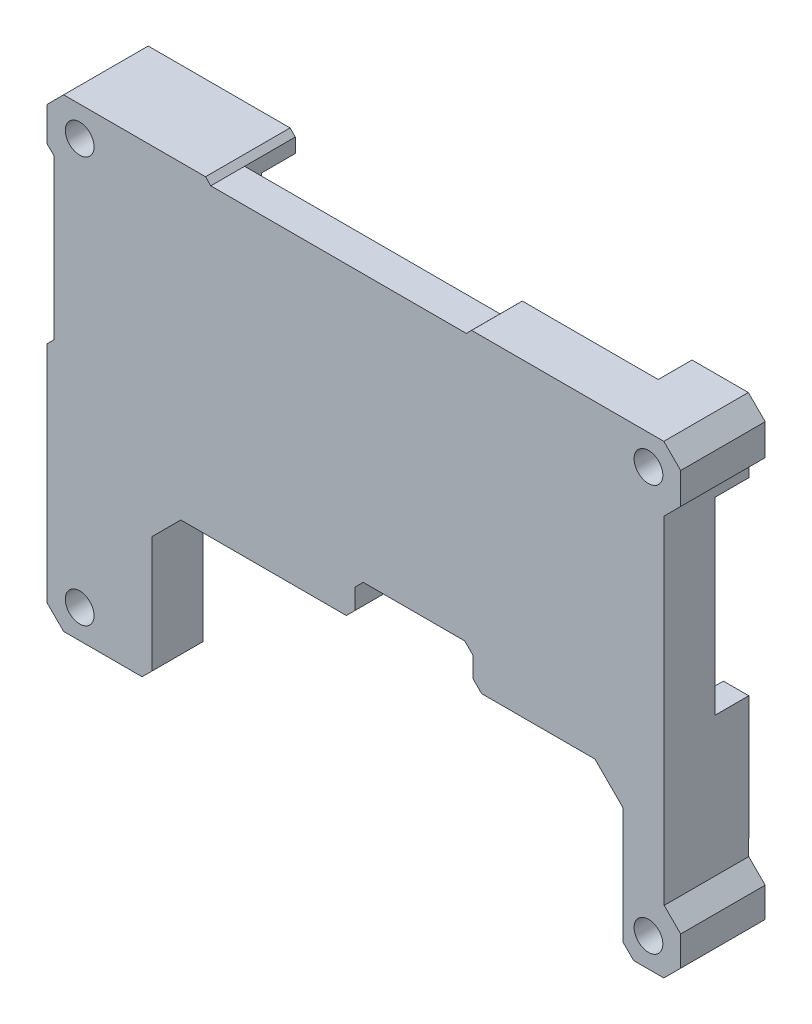
from build123d import *

# Parameters (mm, degrees)
SKETCH_1_W           = 85
SKETCH_1_H           = 65
EXTRUDE_1_DEPTH      = 10
CUT_EXTRUDE_1_REACH  = 109.471
SKETCH_2_R           = 1.7
CUT_EXTRUDE_2_REACH  = 109.471
SKETCH_3_W           = 85
SKETCH_3_H           = 65
CUT_EXTRUDE_4_REACH  = 102.464
CUT_EXTRUDE_7_DEPTH  = 6
CUT_EXTRUDE_8_DEPTH  = 6
CUT_EXTRUDE_11_DEPTH = 4
SKETCH_8_W           = 8
SKETCH_8_H           = 5
CUT_EXTRUDE_12_DEPTH = 1
SKETCH_10_W          = 5.4
SKETCH_10_H          = 6
SKETCH_10_W_2        = 4
EXTRUDE_2_DEPTH      = 3.04
SKETCH_11_W          = 4.2
SKETCH_11_H          = 5
EXTRUDE_3_DEPTH      = 2.300115
SKETCH_12_W          = 12
SKETCH_12_H          = 6
EXTRUDE_4_DEPTH      = 2.89
SKETCH_13_W          = 6.499986347
SKETCH_13_H          = 5.115524378
EXTRUDE_5_DEPTH      = 3.6
SKETCH_14_W          = 6
SKETCH_14_H          = 7
EXTRUDE_6_DEPTH      = 2.890002
SKETCH_15_W          = 14
SKETCH_15_H          = 4.4
CUT_EXTRUDE_13_DEPTH = 6
CHAMFER_1_SIZE       = 1
CHAMFER_2_SIZE       = 0.6
CHAMFER_3_SIZE       = 0.6
CHAMFER_4_SIZE       = 0.6
CHAMFER_5_SIZE       = 0.6
CHAMFER_6_SIZE       = 0.6


with BuildPart() as part:
    # 草图1 → 凸台-拉伸1 (new body)
    with BuildSketch(Plane.XY):
        with Locations((42.5, 32.5)):
            Rectangle(SKETCH_1_W, SKETCH_1_H)
    extrude(amount=EXTRUDE_1_DEPTH)

    # 草图2 → 切除-拉伸1 (cut, up to next)
    with BuildSketch(Plane(origin=(0, 0, 0), x_dir=(-1, 0, 0), z_dir=(0, 0, -1)), mode=Mode.PRIVATE) as cut_extrude_1_sk1:
        with Locations((-76.166921514, 56.442524765)):
            Circle(SKETCH_2_R)
    cut_extrude_1_tool1 = extrude(cut_extrude_1_sk1.sketch, amount=-CUT_EXTRUDE_1_REACH, mode=Mode.PRIVATE) & part.part
    # 草图2 → 切除-拉伸1 (cut, up to next)
    with BuildSketch(Plane(origin=(0, 0, 0), x_dir=(-1, 0, 0), z_dir=(0, 0, -1)), mode=Mode.PRIVATE) as cut_extrude_1_sk2:
        with Locations((-8.888803658, 56.442524765)):
            Circle(SKETCH_2_R)
    cut_extrude_1_tool2 = extrude(cut_extrude_1_sk2.sketch, amount=-CUT_EXTRUDE_1_REACH, mode=Mode.PRIVATE) & part.part
    # 草图2 → 切除-拉伸1 (cut, up to next)
    with BuildSketch(Plane(origin=(0, 0, 0), x_dir=(-1, 0, 0), z_dir=(0, 0, -1)), mode=Mode.PRIVATE) as cut_extrude_1_sk3:
        with Locations((-76.166921514, 8.41508509)):
            Circle(SKETCH_2_R)
    cut_extrude_1_tool3 = extrude(cut_extrude_1_sk3.sketch, amount=-CUT_EXTRUDE_1_REACH, mode=Mode.PRIVATE) & part.part
    # 草图2 → 切除-拉伸1 (cut, up to next)
    with BuildSketch(Plane(origin=(0, 0, 0), x_dir=(-1, 0, 0), z_dir=(0, 0, -1)), mode=Mode.PRIVATE) as cut_extrude_1_sk4:
        with Locations((-8.888803658, 8.41508509)):
            Circle(SKETCH_2_R)
    cut_extrude_1_tool4 = extrude(cut_extrude_1_sk4.sketch, amount=-CUT_EXTRUDE_1_REACH, mode=Mode.PRIVATE) & part.part
    add(cut_extrude_1_tool1.solids().sort_by_distance((76.166922, 56.442525, 0))[0], mode=Mode.SUBTRACT)
    add(cut_extrude_1_tool2.solids().sort_by_distance((8.888804, 56.442525, 0))[0], mode=Mode.SUBTRACT)
    add(cut_extrude_1_tool3.solids().sort_by_distance((76.166922, 8.415085, 0))[0], mode=Mode.SUBTRACT)
    add(cut_extrude_1_tool4.solids().sort_by_distance((8.888804, 8.415085, 0))[0], mode=Mode.SUBTRACT)

    # 草图3 → 切除-拉伸2 (cut, up to next)
    with BuildSketch(Plane(origin=(0, 0, 0), x_dir=(-1, 0, 0), z_dir=(0, 0, -1)), mode=Mode.PRIVATE) as cut_extrude_2_sk1:
        with Locations((-42.5, 32.5)):
            Rectangle(SKETCH_3_W, SKETCH_3_H)
        Polygon((-5, 33.462892894), (-5.871324699, 34.334217592), (-5.87504445, 53.137061214), (-5, 54.017366187), (-5, 57.982143592), (-6.992565577, 59.974709169), (-23.773560915, 59.974709169), (-24.394872914, 59.353397171), (-54.61482093, 59.349677419), (-55.245113202, 59.974709169), (-77.982184232, 59.974709169), (-79.974749809, 57.982143592), (-79.97474981, 54.295829484), (-78.032030648, 52.353110322), (-78.028310897, 12.45999492), (-79.97474981, 10.508295484), (-79.97474981, 6.992565577), (-77.982184232, 5), (-74.414239441, 5), (-73.152434681, 6.26180476), (-60.043505207, 6.265524511), (-58.772720173, 5), (-32.926479725, 5), (-31.743585303, 6.182894422), (-17.461559563, 6.186614173), (-16.269684867, 5), (-6.992565577, 5), (-5, 6.992565577), align=None, mode=Mode.SUBTRACT)
    cut_extrude_2_tool1 = extrude(cut_extrude_2_sk1.sketch, amount=-CUT_EXTRUDE_2_REACH, mode=Mode.PRIVATE) & part.part
    add(cut_extrude_2_tool1.solids().sort_by_distance((42.5, 63.929953, 0))[0], mode=Mode.SUBTRACT)

    # 草图4 → 切除-拉伸4 (cut, up to next)
    with BuildSketch(Plane(origin=(0, 0, 0), x_dir=(-1, 0, 0), z_dir=(0, 0, -1)), mode=Mode.PRIVATE) as cut_extrude_4_sk1:
        Polygon((-73.152434681, 6.26180476), (-73.152434681, 20.032317315), (-69.831576581, 23.353175415), (-46.787984184, 23.353175415), (-20.851296271, 23.353175415), (-17.461559563, 19.963438707), (-17.461559563, 6.186614173), (-17.461559563, 0.193960815), (-73.152434681, 0.193960815), align=None)
    cut_extrude_4_tool1 = extrude(cut_extrude_4_sk1.sketch, amount=-CUT_EXTRUDE_4_REACH, mode=Mode.PRIVATE) & part.part
    add(cut_extrude_4_tool1.solids().sort_by_distance((45.311727, 11.681443, 0))[0], mode=Mode.SUBTRACT)

    # 草图5 → 切除-拉伸7 (cut)
    with BuildSketch(Plane(origin=(0, 0, 0), x_dir=(-1, 0, 0), z_dir=(0, 0, -1))):
        Polygon((-24.394872914, 59.353397171), (-24.394872914, 53.906418167), (-25.526104495, 52.774908066), (-53.482640788, 52.774908066), (-54.614150889, 53.906139647), (-54.61482093, 59.349677419), align=None)
    extrude(amount=-CUT_EXTRUDE_7_DEPTH, mode=Mode.SUBTRACT)

    # 草图6 → 切除-拉伸8 (cut)
    with BuildSketch(Plane(origin=(0, 0, 0), x_dir=(-1, 0, 0), z_dir=(0, 0, -1))):
        Polygon((-5.871324699, 34.334217592), (-11.136213102, 34.334217592), (-11.687697798, 35.836171197), (-11.687697798, 43.836171197), (-10.273484235, 45.250384759), (-5.873484235, 45.250384759), align=None)
    extrude(amount=-CUT_EXTRUDE_8_DEPTH, mode=Mode.SUBTRACT)

    # 草图7 → 切除-拉伸11 (cut)
    with BuildSketch(Plane(origin=(0, 0, 0), x_dir=(-1, 0, 0), z_dir=(0, 0, -1))):
        Polygon((-74.432117646, 51.26230094), (-76.432117646, 51.26230094), (-78.031928938, 51.26230094), (-78.029847328, 28.93771831), (-75.029847328, 28.93771831), (-75.029847328, 13.93771831), (-73.152434681, 12.060305663), (-73.152434681, 20.032317315), (-69.831576581, 23.353175415), (-20.851296271, 23.353175415), (-17.461559563, 19.963438707), (-17.461559563, 6.186614173), (-16.269684867, 5), (-12.014024847, 5), (-12.014024847, 10.599811284), (-10.599811284, 12.014024847), (-6.599811284, 12.014024847), (-5, 12.014024847), (-5, 33.462892894), (-5.871324699, 34.334217592), (-11.136213102, 34.334217592), (-11.687697798, 35.836171197), (-11.687697798, 43.836171197), (-10.273484235, 45.250384759), (-5.873484235, 45.250384759), (-5.87504445, 53.137061214), (-9.87504445, 53.137061214), (-12.071959353, 55.333976117), (-12.071959353, 58.333976117), (-23.061659554, 58.333976117), (-23.732127818, 57.663342778), (-24.394872914, 57.663261201), (-24.394872914, 53.906418167), (-25.526104495, 52.774908066), (-53.482640788, 52.774908066), (-54.614150889, 53.906139647), (-54.61482093, 59.349677419), (-55.245113202, 59.974709169), (-71.319520701, 59.974709169), (-71.319520701, 58.374897885), (-71.319520701, 54.374897885), align=None)
    extrude(amount=-CUT_EXTRUDE_11_DEPTH, mode=Mode.SUBTRACT)

    # 草图8 → 切除-拉伸12 (cut)
    with BuildSketch(Plane(origin=(0, 0, 4), x_dir=(-1, 0, 0), z_dir=(0, 0, -1))):
        with Locations((-69.348077333, 43.45871309)):
            Rectangle(SKETCH_8_W, SKETCH_8_H)
    extrude(amount=-CUT_EXTRUDE_12_DEPTH, mode=Mode.SUBTRACT)

    # 草图10 → 凸台-拉伸2 (add)
    with BuildSketch(Plane(origin=(0, 0, 4), x_dir=(-1, 0, 0), z_dir=(0, 0, -1))):
        with Locations((-44.246532103, 31.889800214)):
            Rectangle(SKETCH_10_W, SKETCH_10_H)
        with Locations((-39.546532103, 31.889800214)):
            Rectangle(SKETCH_10_W_2, SKETCH_10_H)
        with Locations((-34.846532103, 31.889800214)):
            Rectangle(SKETCH_10_W, SKETCH_10_H)
    extrude(amount=EXTRUDE_2_DEPTH)

    # 草图11 → 凸台-拉伸3 (add)
    with BuildSketch(Plane(origin=(0, 0, 4), x_dir=(-1, 0, 0), z_dir=(0, 0, -1))):
        with Locations((-38.731800654, 41.192864876)):
            Rectangle(SKETCH_11_W, SKETCH_11_H)
    extrude(amount=EXTRUDE_3_DEPTH)

    # 草图12 → 凸台-拉伸4 (add)
    with BuildSketch(Plane(origin=(0, 0, 4), x_dir=(-1, 0, 0), z_dir=(0, 0, -1))):
        with Locations((-24.610605003, 27.685920752)):
            Rectangle(SKETCH_12_W, SKETCH_12_H)
    extrude(amount=EXTRUDE_4_DEPTH)

    # 草图13 → 凸台-拉伸5 (add)
    with BuildSketch(Plane(origin=(0, 0, 4), x_dir=(-1, 0, 0), z_dir=(0, 0, -1))):
        with Locations((-61.319842519, 38.061085021)):
            Rectangle(SKETCH_13_W, SKETCH_13_H)
    extrude(amount=EXTRUDE_5_DEPTH)

    # 草图14 → 凸台-拉伸6 (add)
    with BuildSketch(Plane(origin=(0, 0, 4), x_dir=(-1, 0, 0), z_dir=(0, 0, -1))):
        with Locations((-62.740849727, 27.111901224)):
            Rectangle(SKETCH_14_W, SKETCH_14_H)
    extrude(amount=EXTRUDE_6_DEPTH)

    # 草图15 → 切除-拉伸13 (cut)
    with BuildSketch(Plane.XY.offset(10)):
        with Locations((48.428848604, 25.553175415)):
            Rectangle(SKETCH_15_W, SKETCH_15_H)
    extrude(amount=-CUT_EXTRUDE_13_DEPTH, mode=Mode.SUBTRACT)

    # 倒角1
    chamfer_1_edges = [part.edges().sort_by_distance(p)[0] for p in [
        (55.428848604, 23.353175415, 7),
        (55.428848604, 27.753175415, 7),
        (41.428848604, 27.753175415, 7),
        (41.428848604, 23.353175415, 7),
    ]]
    chamfer(chamfer_1_edges, length=CHAMFER_1_SIZE)

    # 倒角2
    chamfer_2_edges = [part.edges().sort_by_distance(p)[0] for p in [
        (64.569835693, 38.061085021, 4),
        (61.31984252, 35.503322832, 4),
        (58.069849346, 38.061085021, 4),
        (61.31984252, 40.61884721, 4),
    ]]
    chamfer(chamfer_2_edges, length=CHAMFER_2_SIZE)

    # 倒角3
    chamfer_3_edges = [part.edges().sort_by_distance(p)[0] for p in [
        (39.546532103, 28.889800214, 4),
        (46.946532103, 31.889800214, 4),
        (39.546532103, 34.889800214, 4),
        (32.146532103, 31.889800214, 4),
    ]]
    chamfer(chamfer_3_edges, length=CHAMFER_3_SIZE)

    # 倒角4
    chamfer_4_edges = [part.edges().sort_by_distance(p)[0] for p in [
        (30.610605003, 27.685920752, 4),
        (24.610605003, 24.685920752, 4),
        (18.610605003, 27.685920752, 4),
        (24.610605003, 30.685920752, 4),
    ]]
    chamfer(chamfer_4_edges, length=CHAMFER_4_SIZE)

    # 倒角5
    chamfer_5_edges = [part.edges().sort_by_distance(p)[0] for p in [
        (40.831800654, 41.192864876, 4),
        (38.731800654, 38.692864876, 4),
        (36.631800654, 41.192864876, 4),
        (38.731800654, 43.692864876, 4),
    ]]
    chamfer(chamfer_5_edges, length=CHAMFER_5_SIZE)

    # 倒角6
    chamfer_6_edges = [part.edges().sort_by_distance(p)[0] for p in [
        (65.740849727, 27.111901224, 4),
        (59.740849727, 27.111901224, 4),
        (62.740849727, 30.611901224, 4),
    ]]
    chamfer(chamfer_6_edges, length=CHAMFER_6_SIZE)


solid = part.part
